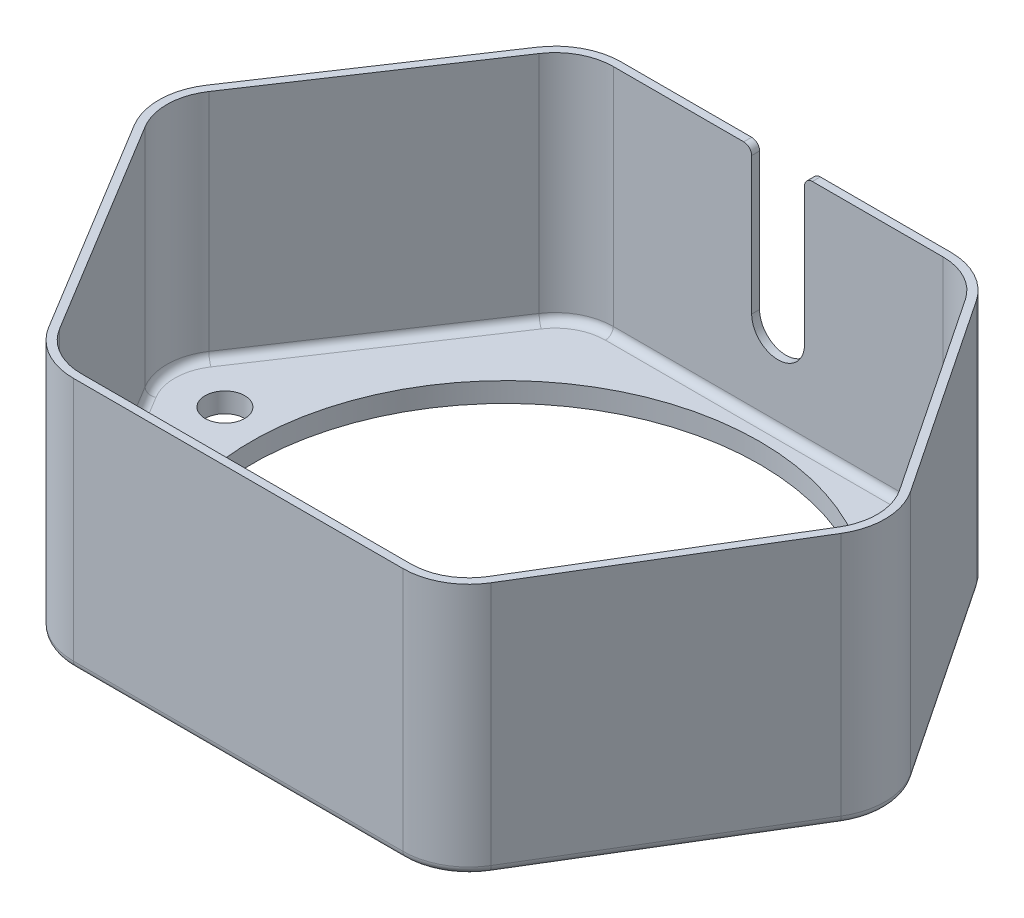
from build123d import *
from build123d.topology import SkipClean

# Parameters (mm, degrees)
ESQUISSE1_R             = 3
BOSS_EXTRU_1_DEPTH      = 3
EXTRU_MINCE1_DEPTH      = 35.3
ENL_V_MAT_EXTRU_1_DEPTH = 10
CONG_1_R                = 1.2


with BuildPart() as part:
    # Esquisse1 → Boss.-Extru.1 (new body)
    with BuildSketch(Plane(origin=(0, 0, 0), x_dir=(1, 0, 0), z_dir=(0, 1, 0))):
        with BuildLine():
            Line((0, 40), (0, 36))
            ThreePointArc((0, 36), (-38.5, -2.5), (0, -41))
            Line((0, -41), (0, -43))
            Line((0, -43), (-24.964670006, -43))
            ThreePointArc((-24.964670006, -43), (-29.868898482, -41.714846129), (-33.512589316, -38.189708611))
            Line((-33.512589316, -38.189708611), (-53.54791931, -5.189708611))
            ThreePointArc((-53.54791931, -5.189708611), (-54.99767043, 0.215837849), (-53.315980127, 5.553780202))
            Line((-53.315980127, 5.553780202), (-33.280650133, 35.553780202))
            ThreePointArc((-33.280650133, 35.553780202), (-29.679656643, 38.818667757), (-24.964670006, 40))
            Line((-24.964670006, 40), (0, 40))
        make_face()
        with Locations(Location((-45, 0, 0), (0, 0, 270))):
            Circle(ESQUISSE1_R, mode=Mode.SUBTRACT)
    extrude(amount=BOSS_EXTRU_1_DEPTH)

    # Esquisse2 → Extru.-Mince1 (add)
    with BuildSketch(Plane(origin=(0, 3, 0), x_dir=(1, 0, 0), z_dir=(0, 1, 0))):
        with BuildLine():
            Line((0, 40), (-24.964670006, 40))
            ThreePointArc((-24.964670006, 40), (-29.679656643, 38.818667757), (-33.280650133, 35.553780202))
            Line((-33.280650133, 35.553780202), (-53.315980127, 5.553780202))
            ThreePointArc((-53.315980127, 5.553780202), (-54.99767043, 0.215837849), (-53.54791931, -5.189708611))
            Line((-53.54791931, -5.189708611), (-33.512589316, -38.189708611))
            ThreePointArc((-33.512589316, -38.189708611), (-29.868898482, -41.714846129), (-24.964670006, -43))
            Line((-24.964670006, -43), (0, -43))
            Line((0, -43), (0, -41.8))
            Line((0, -41.8), (-24.964670006, -41.8))
            ThreePointArc((-24.964670006, -41.8), (-29.280391065, -40.669064594), (-32.486838999, -37.566943577))
            Line((-32.486838999, -37.566943577), (-52.522168993, -4.566943577))
            ThreePointArc((-52.522168993, -4.566943577), (-53.797949978, 0.189937307), (-52.318062511, 4.887326578))
            Line((-52.318062511, 4.887326578), (-32.282732517, 34.887326578))
            ThreePointArc((-32.282732517, 34.887326578), (-29.113858247, 37.760427626), (-24.964670006, 38.8))
            Line((-24.964670006, 38.8), (0, 38.8))
            Line((0, 38.8), (0, 40))
        make_face()
    extrude(amount=EXTRU_MINCE1_DEPTH)

    # Esquisse3 → Enlèv. mat.-Extru.1 (cut)
    with BuildSketch(Plane(origin=(0, 0, -40), x_dir=(-1, 0, 0), z_dir=(0, 0, -1))):
        with BuildLine():
            Line((-4, 16.3), (-4, 38.3))
            ThreePointArc((-4, 38.3), (0, 42.3), (4, 38.3))
            Line((4, 38.3), (4, 16.3))
            ThreePointArc((4, 16.3), (0, 12.3), (-4, 16.3))
        make_face()
    extrude(amount=-ENL_V_MAT_EXTRU_1_DEPTH, mode=Mode.SUBTRACT)

    # Congé1
    cong_1_edges = [part.edges().sort_by_distance(p)[0] for p in [
        (-12.482335003, 3, 41.8),
        (-29.280391065, 3, 40.669064594),
        (-42.504503996, 3, 21.066943577),
        (-53.797949978, 3, -0.189937307),
        (-42.300397514, 3, -19.887326578),
        (-29.113858247, 3, -37.760427626),
        (-12.482335003, 3, -38.8),
        (-4, 38.3, -39.4),
        (-12.482335003, 0, -40),
        (-29.679656643, 0, -38.818667757),
        (-43.29831513, 0, -20.553780202),
        (-54.99767043, 0, -0.215837849),
        (-43.530254313, 0, 21.689708611),
        (-29.868898482, 0, 41.714846129),
        (-12.482335003, 0, 43),
    ]]
    fillet(cong_1_edges, radius=CONG_1_R)

    # Symétrie1: part across plane


with BuildPart() as part_1:
    with SkipClean():  # the faces are left unmerged after this step: merging them gives an invalid solid
        add(part.part)
        add(part.part.mirror(Plane(origin=(0, 3, 41), x_dir=(0, 0, 1), z_dir=(-1, 0, 0))))


solid = part_1.part
